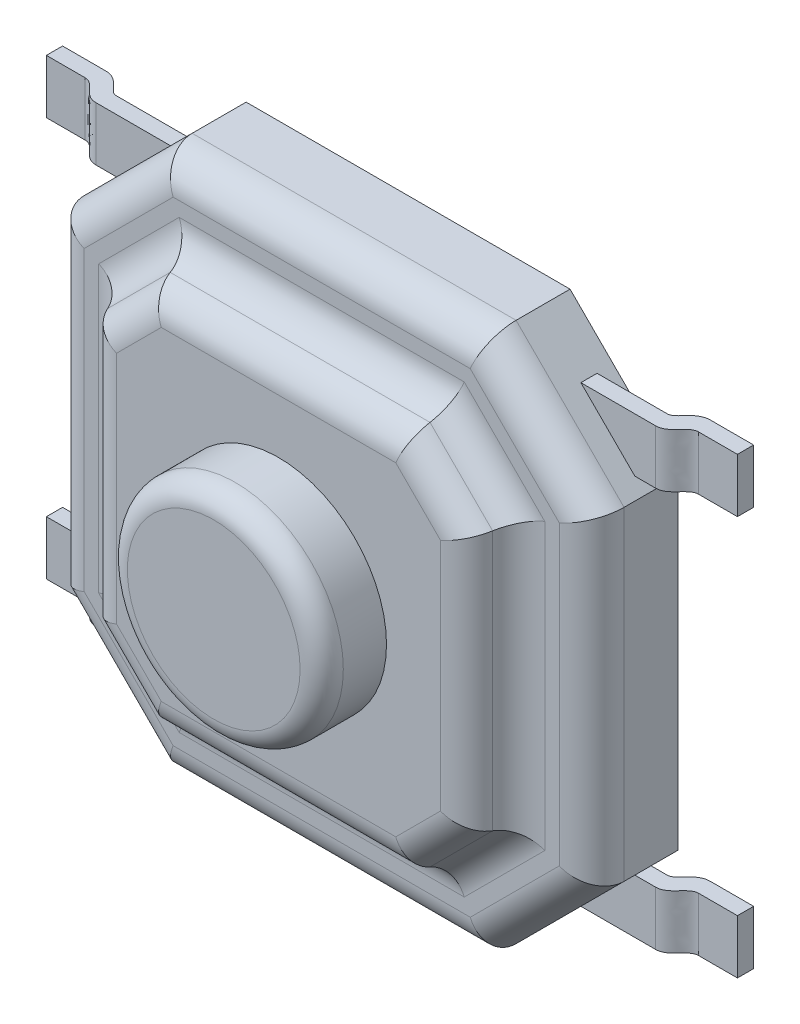
from build123d import *

# Parameters (mm, degrees)
BOSS_EXTRUDE1_DEPTH = 0.8
BOSS_EXTRUDE2_DEPTH = 0.4
SKETCH3_R           = 1
BOSS_EXTRUDE3_DEPTH = 0.6
FILLET1_R           = 0.3
FILLET2_R           = 0.3
FILLET3_R           = 0.3
FILLET4_R           = 0.2
BOSS_EXTRUDE4_DEPTH = 0.25


with BuildPart() as part:
    # Sketch1 → Boss-Extrude1 (new body)
    with BuildSketch(Plane.XY):
        Polygon((-1.5, 2.5), (1.5, 2.5), (2.5, 1.5), (2.5, -1.5), (1.5, -2.5), (-1.5, -2.5), (-2.5, -1.5), (-2.5, 1.5), align=None)
    extrude(amount=BOSS_EXTRUDE1_DEPTH)

    # Sketch2 → Boss-Extrude2 (add)
    with BuildSketch(Plane.XY.offset(0.8)):
        Polygon((-1.210050506, 1.8), (-1.8, 1.210050506), (-1.8, -1.210050506), (-1.210050506, -1.8), (1.210050506, -1.8), (1.8, -1.210050506), (1.8, 1.210050506), (1.210050506, 1.8), align=None)
    extrude(amount=BOSS_EXTRUDE2_DEPTH)

    # Sketch3 → Boss-Extrude3 (add)
    with BuildSketch(Plane.XY.offset(1.2)):
        Circle(SKETCH3_R)
    extrude(amount=BOSS_EXTRUDE3_DEPTH)

    # Fillet1
    fillet1_edges = [part.edges().sort_by_distance(p)[0] for p in [
        (1.505025253, 1.505025253, 1.2),
        (0, 1.8, 1.2),
        (-1.505025253, 1.505025253, 1.2),
        (-1.8, 0, 1.2),
        (-1.505025253, -1.505025253, 1.2),
        (0, -1.8, 1.2),
        (1.505025253, -1.505025253, 1.2),
        (1.8, 0, 1.2),
    ]]
    fillet(fillet1_edges, radius=FILLET1_R)

    # Fillet2
    fillet2_edges = [part.edges().sort_by_distance(p)[0] for p in [
        (-2, 2, 0.8),
        (-2.5, 0, 0.8),
        (-2, -2, 0.8),
        (0, -2.5, 0.8),
        (2, -2, 0.8),
        (2.5, 0, 0.8),
        (2, 2, 0.8),
        (0, 2.5, 0.8),
    ]]
    fillet(fillet2_edges, radius=FILLET2_R)

    # Fillet3
    fillet3_edges = [part.edges().sort_by_distance(p)[0] for p in [
        (0, -1.8, 0.8),
        (1.505025253, -1.505025253, 0.8),
        (1.8, 0, 0.8),
        (1.505025253, 1.505025253, 0.8),
        (0, 1.8, 0.8),
        (-1.505025253, 1.505025253, 0.8),
        (-1.8, 0, 0.8),
        (-1.505025253, -1.505025253, 0.8),
    ]]
    fillet(fillet3_edges, radius=FILLET3_R)

    # Fillet4
    fillet4_edges = [part.edges().sort_by_distance(p)[0] for p in [
        (-1, 0, 1.8),
    ]]
    fillet(fillet4_edges, radius=FILLET4_R)

    # Sketch4 → Boss-Extrude4 (add, symmetric)
    with BuildSketch(Plane(origin=(0, 1.85, 0), x_dir=(1, 0, 0), z_dir=(0, 1, 0))):
        with BuildLine():
            Line((0, -0.15), (-2.55, -0.15))
            add(Edge.make_bspline(
                [(-2.8, 0), (-2.662431202, 0), (-2.630462892, -0.15), (-2.55, -0.15)],
                knots=[0, 0, 0, 0, 1, 1, 1, 1], degree=3))
            Line((-2.8, 0), (-3.2, 0))
            Line((-3.2, 0), (-3.2, -0.15))
            Line((-3.2, -0.15), (-2.841547595, -0.15))
            add(Edge.make_bspline(
                [(-2.591547595, -0.3), (-2.713318055, -0.3), (-2.744365063, -0.15), (-2.841547595, -0.15)],
                knots=[0, 0, 0, 0, 1, 1, 1, 1], degree=3))
            Line((-2.591547595, -0.3), (0, -0.3))
            Line((0, -0.3), (2.591547595, -0.3))
            add(Edge.make_bspline(
                [(2.591547595, -0.3), (2.713318055, -0.3), (2.744365063, -0.15), (2.841547595, -0.15)],
                knots=[0, 0, 0, 0, 1, 1, 1, 1], degree=3))
            Line((2.841547595, -0.15), (3.2, -0.15))
            Line((3.2, -0.15), (3.2, 0))
            Line((3.2, 0), (2.8, 0))
            add(Edge.make_bspline(
                [(2.8, 0), (2.662431202, 0), (2.630462892, -0.15), (2.55, -0.15)],
                knots=[0, 0, 0, 0, 1, 1, 1, 1], degree=3))
            Line((2.55, -0.15), (0, -0.15))
        make_face()
    boss_extrude4 = extrude(amount=BOSS_EXTRUDE4_DEPTH, both=True)

    # Mirror1: Boss-Extrude4 across plane
    add(boss_extrude4.mirror(Plane.ZX))


solid = part.part
